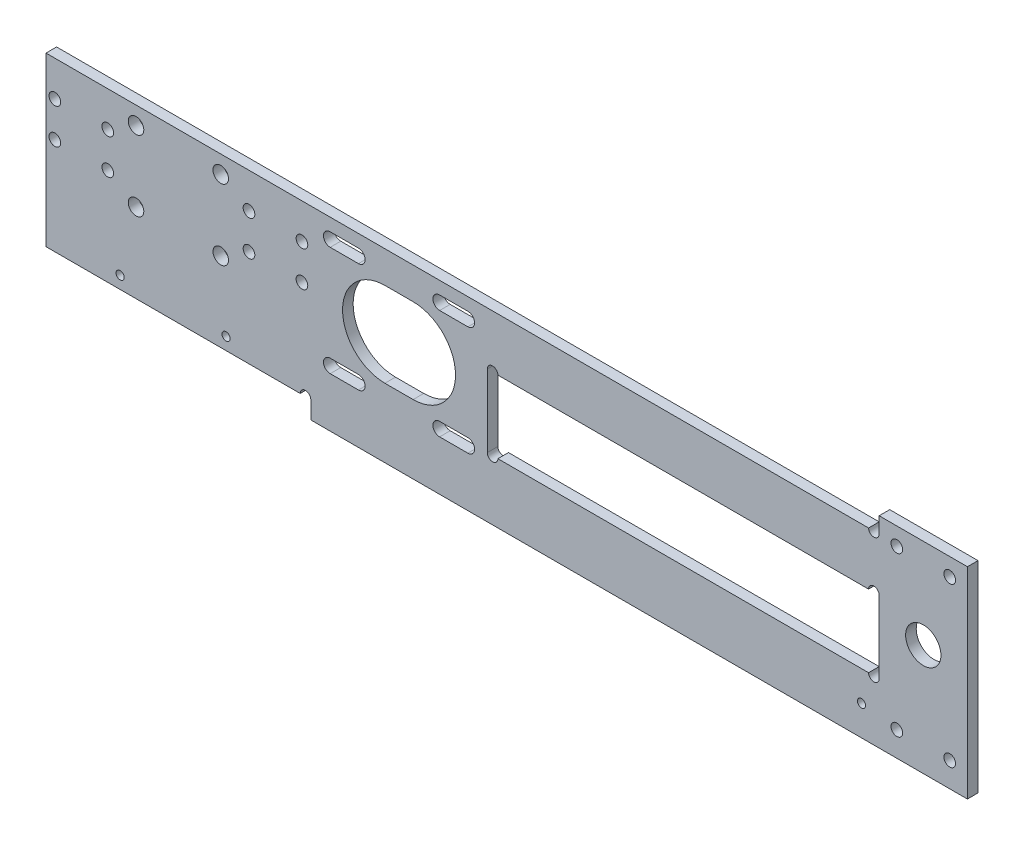
from build123d import *

# Parameters (mm, degrees)
SKETCH_1_W           = 75
SKETCH_1_H           = 30
EXTRUDE_1_DEPTH      = 3
HOLE_WIZARD_1_D      = 4.4
HOLE_WIZARD_2_D      = 3.3
SKETCH_8_W           = 45
SKETCH_8_H           = 42
EXTRUDE_2_DEPTH      = 3
HOLE_WIZARD_3_D      = 3.8
SKETCH_13_W          = 15
SKETCH_13_H          = 42
EXTRUDE_3_DEPTH      = 3
CUT_EXTRUDE_3_DEPTH  = 3
CUT_EXTRUDE_5_DEPTH  = 3
CUT_EXTRUDE_6_DEPTH  = 3
SKETCH_18_W          = 75
SKETCH_18_H          = 2.504084813
SKETCH_18_H_2        = 3
SKETCH_18_W_2        = 161
SKETCH_18_H_3        = 17
EXTRUDE_4_DEPTH      = 3
HOLE_WIZARD_4_D      = 2.3
SKETCH_22_W          = 25
SKETCH_22_H          = 42
EXTRUDE_5_DEPTH      = 3
HOLE_WIZARD_5_D      = 10
HOLE_WIZARD_5_DEPTH  = 3
HOLE_WIZARD_7_D      = 3.3
HOLE_WIZARD_7_DEPTH  = 3.001
SKETCH_31_W          = 25
SKETCH_31_H          = 15
EXTRUDE_6_DEPTH      = 3
HOLE_WIZARD_8_D      = 3.3
HOLE_WIZARD_8_DEPTH  = 3
SKETCH_36_W          = 161
SKETCH_36_H          = 15
EXTRUDE_7_DEPTH      = 3
HOLE_WIZARD_9_D      = 2.3
SKETCH_40_R          = 12
CUT_EXTRUDE_7_DEPTH  = 10
SKETCH_41_W          = 50
SKETCH_41_H          = 20.504084813
EXTRUDE_8_DEPTH      = 3
HOLE_WIZARD_10_D     = 3.8
HOLE_WIZARD_11_D     = 24
SKETCH_48_W          = 8
SKETCH_48_H          = 3.8
SKETCH_48_H_2        = 24
CUT_EXTRUDE_8_DEPTH  = 3
SKETCH_49_W          = 57
SKETCH_49_H          = 42
CUT_EXTRUDE_9_DEPTH  = 3
SKETCH_50_W          = 3
SKETCH_50_H          = 42
CUT_EXTRUDE_10_DEPTH = 3
SKETCH_51_W          = 75
SKETCH_51_H          = 5
CUT_EXTRUDE_11_DEPTH = 10
HOLE_WIZARD_12_D     = 3
HOLE_WIZARD_13_D     = 3


with BuildPart() as part:
    # 草图1 → 凸台-拉伸1 (new body)
    with BuildSketch(Plane.XY):
        with Locations((37.5, 15)):
            Rectangle(SKETCH_1_W, SKETCH_1_H)
    extrude(amount=EXTRUDE_1_DEPTH)

    # 孔1 (through all)
    with Locations(Plane.XY.offset(3)):
        with Locations((25.5, 25), (49.5, 25), (49.5, 5), (25.5, 5)):
            Hole(HOLE_WIZARD_1_D / 2)

    # 孔2 (through all)
    with Locations(Plane.XY.offset(3)):
        with Locations((2.5, 20), (17.5, 20), (17.5, 10), (2.5, 10), (57.5, 10), (57.5, 20), (72.5, 20), (72.5, 10)):
            Hole(HOLE_WIZARD_2_D / 2)

    # 草图8 → 凸台-拉伸2 (add)
    with BuildSketch(Plane(origin=(0, 0, 0), x_dir=(-1, 0, 0), z_dir=(0, 0, -1))):
        with Locations((22.5, 9)):
            Rectangle(SKETCH_8_W, SKETCH_8_H)
    extrude(amount=-EXTRUDE_2_DEPTH)

    # 孔3 (through all)
    with Locations(Plane.XY.offset(3)):
        with Locations((-39.5, 24.5), (-8.5, 24.5), (-8.5, -6.5), (-39.5, -6.5)):
            Hole(HOLE_WIZARD_3_D / 2)

    # 草图13 → 凸台-拉伸3 (add)
    with BuildSketch(Plane(origin=(0, 0, 0), x_dir=(-1, 0, 0), z_dir=(0, 0, -1))):
        with Locations((52.5, 9)):
            Rectangle(SKETCH_13_W, SKETCH_13_H)
    extrude(amount=-EXTRUDE_3_DEPTH)

    # 草图14 → 切除-拉伸3 (cut)
    with BuildSketch(Plane(origin=(0, 0, 0), x_dir=(-1, 0, 0), z_dir=(0, 0, -1))):
        with BuildLine():
            Line((23.5, 26.4), (8.5, 26.4))
            ThreePointArc((8.5, 26.4), (9.843502884, 25.843502884), (10.4, 24.5))
            ThreePointArc((10.4, 24.5), (9.843502884, 23.156497116), (8.5, 22.6))
            Line((8.5, 22.6), (23.5, 22.6))
            ThreePointArc((23.5, 22.6), (21.6, 24.5), (23.5, 26.4))
        make_face()
        with BuildLine():
            ThreePointArc((25.4, 24.5), (24.843502884, 25.843502884), (23.5, 26.4))
            Line((23.5, 26.4), (23.5, 22.6))
            ThreePointArc((23.5, 22.6), (24.843502884, 23.156497116), (25.4, 24.5))
        make_face()
        with BuildLine():
            Line((23.5, 22.6), (23.5, 26.4))
            ThreePointArc((23.5, 26.4), (21.6, 24.5), (23.5, 22.6))
        make_face()
        with BuildLine():
            ThreePointArc((10.4, 24.5), (9.843502884, 25.843502884), (8.5, 26.4))
            Line((8.5, 26.4), (8.5, 22.6))
            ThreePointArc((8.5, 22.6), (9.843502884, 23.156497116), (10.4, 24.5))
        make_face()
        with BuildLine():
            Line((8.5, 22.6), (8.5, 26.4))
            ThreePointArc((8.5, 26.4), (6.6, 24.5), (8.5, 22.6))
        make_face()
        with BuildLine():
            Line((23.5, -4.6), (8.5, -4.6))
            ThreePointArc((8.5, -4.6), (9.843502884, -5.156497116), (10.4, -6.5))
            ThreePointArc((10.4, -6.5), (9.843502884, -7.843502884), (8.5, -8.4))
            Line((8.5, -8.4), (23.5, -8.4))
            ThreePointArc((23.5, -8.4), (21.6, -6.5), (23.5, -4.6))
        make_face()
        with BuildLine():
            ThreePointArc((10.4, -6.5), (9.843502884, -5.156497116), (8.5, -4.6))
            Line((8.5, -4.6), (8.5, -8.4))
            ThreePointArc((8.5, -8.4), (9.843502884, -7.843502884), (10.4, -6.5))
        make_face()
        with BuildLine():
            Line((8.5, -8.4), (8.5, -4.6))
            ThreePointArc((8.5, -4.6), (6.6, -6.5), (8.5, -8.4))
        make_face()
        with BuildLine():
            ThreePointArc((25.4, -6.5), (24.843502884, -5.156497116), (23.5, -4.6))
            Line((23.5, -4.6), (23.5, -8.4))
            ThreePointArc((23.5, -8.4), (24.843502884, -7.843502884), (25.4, -6.5))
        make_face()
        with BuildLine():
            Line((23.5, -8.4), (23.5, -4.6))
            ThreePointArc((23.5, -4.6), (21.6, -6.5), (23.5, -8.4))
        make_face()
        with BuildLine():
            ThreePointArc((39.5, 26.4), (40.843502884, 25.843502884), (41.4, 24.5))
            Line((41.4, 24.5), (52.6, 24.5))
            ThreePointArc((52.6, 24.5), (53.156497116, 25.843502884), (54.5, 26.4))
            Line((54.5, 26.4), (39.5, 26.4))
        make_face()
        with BuildLine():
            Line((52.6, 24.5), (41.4, 24.5))
            ThreePointArc((41.4, 24.5), (40.843502884, 23.156497116), (39.5, 22.6))
            Line((39.5, 22.6), (54.5, 22.6))
            ThreePointArc((54.5, 22.6), (53.156497116, 23.156497116), (52.6, 24.5))
        make_face()
        with BuildLine():
            Line((41.4, 24.5), (39.5, 24.5))
            Line((39.5, 24.5), (39.5, 22.6))
            ThreePointArc((39.5, 22.6), (40.843502884, 23.156497116), (41.4, 24.5))
        make_face()
        with BuildLine():
            Line((39.5, 26.4), (39.5, 24.5))
            Line((39.5, 24.5), (41.4, 24.5))
            ThreePointArc((41.4, 24.5), (40.843502884, 25.843502884), (39.5, 26.4))
        make_face()
        with BuildLine():
            Line((39.5, 22.6), (39.5, 24.5))
            Line((39.5, 24.5), (39.5, 26.4))
            ThreePointArc((39.5, 26.4), (37.6, 24.5), (39.5, 22.6))
        make_face()
        with BuildLine():
            Line((54.5, 24.5), (54.5, 22.6))
            ThreePointArc((54.5, 22.6), (55.843502884, 23.156497116), (56.4, 24.5))
            ThreePointArc((56.4, 24.5), (55.843502884, 25.843502884), (54.5, 26.4))
            Line((54.5, 26.4), (54.5, 24.5))
        make_face()
        with BuildLine():
            Line((54.5, 24.5), (52.6, 24.5))
            ThreePointArc((52.6, 24.5), (53.156497116, 23.156497116), (54.5, 22.6))
            Line((54.5, 22.6), (54.5, 24.5))
        make_face()
        with BuildLine():
            ThreePointArc((54.5, 26.4), (53.156497116, 25.843502884), (52.6, 24.5))
            Line((52.6, 24.5), (54.5, 24.5))
            Line((54.5, 24.5), (54.5, 26.4))
        make_face()
        with BuildLine():
            Line((54.5, -4.6), (39.5, -4.6))
            ThreePointArc((39.5, -4.6), (40.843502884, -5.156497116), (41.4, -6.5))
            Line((41.4, -6.5), (52.6, -6.5))
            ThreePointArc((52.6, -6.5), (53.156497116, -5.156497116), (54.5, -4.6))
        make_face()
        with BuildLine():
            Line((52.6, -6.5), (41.4, -6.5))
            ThreePointArc((41.4, -6.5), (40.843502884, -7.843502884), (39.5, -8.4))
            Line((39.5, -8.4), (54.5, -8.4))
            ThreePointArc((54.5, -8.4), (53.156497116, -7.843502884), (52.6, -6.5))
        make_face()
        with BuildLine():
            Line((54.5, -6.5), (54.5, -4.6))
            ThreePointArc((54.5, -4.6), (53.156497116, -5.156497116), (52.6, -6.5))
            Line((52.6, -6.5), (54.5, -6.5))
        make_face()
        with BuildLine():
            Line((54.5, -8.4), (54.5, -6.5))
            Line((54.5, -6.5), (52.6, -6.5))
            ThreePointArc((52.6, -6.5), (53.156497116, -7.843502884), (54.5, -8.4))
        make_face()
        with BuildLine():
            ThreePointArc((56.4, -6.5), (55.843502884, -5.156497116), (54.5, -4.6))
            Line((54.5, -4.6), (54.5, -6.5))
            Line((54.5, -6.5), (54.5, -8.4))
            ThreePointArc((54.5, -8.4), (55.843502884, -7.843502884), (56.4, -6.5))
        make_face()
        with BuildLine():
            ThreePointArc((41.4, -6.5), (40.843502884, -5.156497116), (39.5, -4.6))
            Line((39.5, -4.6), (39.5, -6.5))
            Line((39.5, -6.5), (41.4, -6.5))
        make_face()
        with BuildLine():
            Line((41.4, -6.5), (39.5, -6.5))
            Line((39.5, -6.5), (39.5, -8.4))
            ThreePointArc((39.5, -8.4), (40.843502884, -7.843502884), (41.4, -6.5))
        make_face()
        with BuildLine():
            Line((39.5, -6.5), (39.5, -4.6))
            ThreePointArc((39.5, -4.6), (37.6, -6.5), (39.5, -8.4))
            Line((39.5, -8.4), (39.5, -6.5))
        make_face()
    extrude(amount=-CUT_EXTRUDE_3_DEPTH, mode=Mode.SUBTRACT)

    # 草图16 → 切除-拉伸5 (cut)
    with BuildSketch(Plane(origin=(0, 0, 0), x_dir=(-1, 0, 0), z_dir=(0, 0, -1))):
        with BuildLine():
            Line((24, 20.504084813), (24, -2.489125293))
            Line((24, -2.489125293), (39.5, -2.489125293))
            ThreePointArc((39.5, -2.489125293), (50.5, 9), (39.5, 20.489125293))
            Line((39.5, 20.489125293), (39.5, 20.504084813))
            Line((39.5, 20.504084813), (24, 20.504084813))
        make_face()
    extrude(amount=-CUT_EXTRUDE_5_DEPTH, mode=Mode.SUBTRACT)

    # 草图17 → 切除-拉伸6 (cut)
    with BuildSketch(Plane(origin=(0, 0, 0), x_dir=(-1, 0, 0), z_dir=(0, 0, -1))):
        with BuildLine():
            Line((24, -2.489125293), (24, 20.504084813))
            ThreePointArc((24, 20.504084813), (12.495915187, 9), (24, -2.504084813))
            Line((24, -2.504084813), (24, -2.489125293))
        make_face()
    extrude(amount=-CUT_EXTRUDE_6_DEPTH, mode=Mode.SUBTRACT)

    # 草图18 → 凸台-拉伸4 (add)
    with BuildSketch(Plane(origin=(0, 0, 0), x_dir=(-1, 0, 0), z_dir=(0, 0, -1))):
        with Locations((-37.5, -1.252042406)):
            Rectangle(SKETCH_18_W, SKETCH_18_H)
        with Locations((-37.5, -4.004084813)):
            Rectangle(SKETCH_18_W, SKETCH_18_H_2)
        Polygon((0, -12), (0, -5.504084813), (-75, -5.504084813), (-75, -22.504084813), (0, -22.504084813), align=None)
        with Locations((-155.5, -14.004084813)):
            Rectangle(SKETCH_18_W_2, SKETCH_18_H_3)
    extrude(amount=-EXTRUDE_4_DEPTH)

    # 孔4 (through all)
    with Locations(Plane.XY.offset(3)):
        with Locations((51, -14.004084813), (231, -14.004084813)):
            Hole(HOLE_WIZARD_4_D / 2)

    # 草图22 → 凸台-拉伸5 (add)
    with BuildSketch(Plane(origin=(0, 0, 0), x_dir=(-1, 0, 0), z_dir=(0, 0, -1))):
        with Locations((-248.5, -1.504084813)):
            Rectangle(SKETCH_22_W, SKETCH_22_H)
    extrude(amount=-EXTRUDE_5_DEPTH)

    # 孔5
    with Locations(Plane(origin=(0, 0, 0), x_dir=(-1, 0, 0), z_dir=(0, 0, -1))):
        with Locations((-248.5, 8.995915187), (-277.5, 6.995915187)):
            Hole(HOLE_WIZARD_5_D / 2, depth=HOLE_WIZARD_5_DEPTH)

    # 孔7
    with Locations(Plane(origin=(0, 0, 0), x_dir=(-1, 0, 0), z_dir=(0, 0, -1))):
        with Locations((-241, -15.504084813), (-285, -15.504084813), (-270, -15.504084813), (-256, -15.504084813)):
            Hole(HOLE_WIZARD_7_D / 2, depth=HOLE_WIZARD_7_DEPTH)

    # 草图31 → 凸台-拉伸6 (add)
    with BuildSketch(Plane(origin=(0, 0, 0), x_dir=(-1, 0, 0), z_dir=(0, 0, -1))):
        with Locations((-248.5, 26.995915187)):
            Rectangle(SKETCH_31_W, SKETCH_31_H)
    extrude(amount=-EXTRUDE_6_DEPTH)

    # 孔8
    with Locations(Plane(origin=(0, 0, 0), x_dir=(-1, 0, 0), z_dir=(0, 0, -1))):
        with Locations((-241, 29.495915187), (-285, 29.495915187), (-270, 29.495915187), (-256, 29.495915187)):
            Hole(HOLE_WIZARD_8_D / 2, depth=HOLE_WIZARD_8_DEPTH)

    # 草图36 → 凸台-拉伸7 (add)
    with BuildSketch(Plane(origin=(0, 0, 0), x_dir=(-1, 0, 0), z_dir=(0, 0, -1))):
        with Locations((-155.5, 22.5)):
            Rectangle(SKETCH_36_W, SKETCH_36_H)
    extrude(amount=-EXTRUDE_7_DEPTH)

    # 孔9 (through all)
    with Locations(Plane(origin=(0, 0, 0), x_dir=(-1, 0, 0), z_dir=(0, 0, -1))):
        with Locations((-21, -14.004084813)):
            Hole(HOLE_WIZARD_9_D / 2)

    # 草图40 → 切除-拉伸7 (cut)
    with BuildSketch(Plane(origin=(0, 0, 0), x_dir=(-1, 0, 0), z_dir=(0, 0, -1))):
        with Locations((39, 9)):
            Circle(SKETCH_40_R)
        with Locations((24, 9)):
            Circle(SKETCH_40_R)
        with BuildLine():
            Line((39, 21), (24, 21))
            ThreePointArc((24, 21), (27.974294656, 20.322763885), (31.5, 18.367496998))
            ThreePointArc((31.5, 18.367496998), (35.025705344, 20.322763885), (39, 21))
        make_face()
        with BuildLine():
            ThreePointArc((31.5, -0.367496998), (27.974294656, -2.322763885), (24, -3))
            Line((24, -3), (39, -3))
            ThreePointArc((39, -3), (35.025705344, -2.322763885), (31.5, -0.367496998))
        make_face()
    extrude(amount=-CUT_EXTRUDE_7_DEPTH, mode=Mode.SUBTRACT)

    # 草图41 → 凸台-拉伸8 (add)
    with BuildSketch(Plane(origin=(0, 0, 0), x_dir=(-1, 0, 0), z_dir=(0, 0, -1))):
        with Locations((-100, 4.747957594)):
            Rectangle(SKETCH_41_W, SKETCH_41_H)
    extrude(amount=-EXTRUDE_8_DEPTH)

    # 孔10 (through all)
    with Locations(Plane(origin=(0, 0, 0), x_dir=(-1, 0, 0), z_dir=(0, 0, -1))):
        with Locations((-119.5, 24.5), (-111.5, 24.5), (-88.5, 24.5), (-80.5, 24.5), (-88.5, -6.5), (-80.5, -6.5), (-119.5, -6.5), (-111.5, -6.5)):
            Hole(HOLE_WIZARD_10_D / 2)

    # 孔11 (through all)
    with Locations(Plane(origin=(0, 0, 0), x_dir=(-1, 0, 0), z_dir=(0, 0, -1))):
        with Locations((-104, 9), (-96, 9)):
            Hole(HOLE_WIZARD_11_D / 2)

    # 草图48 → 切除-拉伸8 (cut)
    with BuildSketch(Plane(origin=(0, 0, 0), x_dir=(-1, 0, 0), z_dir=(0, 0, -1))):
        with Locations((-115.5, 24.5)):
            Rectangle(SKETCH_48_W, SKETCH_48_H)
        with Locations((-84.5, 24.5)):
            Rectangle(SKETCH_48_W, SKETCH_48_H)
        with Locations((-115.5, -6.5)):
            Rectangle(SKETCH_48_W, SKETCH_48_H)
        with Locations((-84.5, -6.5)):
            Rectangle(SKETCH_48_W, SKETCH_48_H)
        with Locations((-100, 9)):
            Rectangle(SKETCH_48_W, SKETCH_48_H_2)
    extrude(amount=-CUT_EXTRUDE_8_DEPTH, mode=Mode.SUBTRACT)

    # 草图49 → 切除-拉伸9 (cut)
    with BuildSketch(Plane(origin=(0, 0, 0), x_dir=(-1, 0, 0), z_dir=(0, 0, -1))):
        with Locations((31.5, 9)):
            Rectangle(SKETCH_49_W, SKETCH_49_H)
    extrude(amount=-CUT_EXTRUDE_9_DEPTH, mode=Mode.SUBTRACT)

    # 草图50 → 切除-拉伸10 (cut)
    with BuildSketch(Plane(origin=(0, 0, 0), x_dir=(-1, 0, 0), z_dir=(0, 0, -1))):
        with Locations((1.5, 9)):
            Rectangle(SKETCH_50_W, SKETCH_50_H)
    extrude(amount=-CUT_EXTRUDE_10_DEPTH, mode=Mode.SUBTRACT)

    # 草图51 → 切除-拉伸11 (cut)
    with BuildSketch(Plane(origin=(0, 0, 0), x_dir=(-1, 0, 0), z_dir=(0, 0, -1))):
        with Locations((-37.5, -20.004084813)):
            Rectangle(SKETCH_51_W, SKETCH_51_H)
    extrude(amount=-CUT_EXTRUDE_11_DEPTH, mode=Mode.SUBTRACT)

    # 孔12 (through all)
    with Locations(Plane(origin=(0, 0, 0), x_dir=(-1, 0, 0), z_dir=(0, 0, -1))):
        with Locations((-234.5, 15), (-234.5, -5.504084813), (-126.5, -5.504084813), (-126.5, 15)):
            Hole(HOLE_WIZARD_12_D / 2)

    # 孔13 (through all)
    with Locations(Plane(origin=(0, 0, 0), x_dir=(-1, 0, 0), z_dir=(0, 0, -1))):
        with Locations((-234.5, 30), (-73.5, -17.504084813)):
            Hole(HOLE_WIZARD_13_D / 2)


solid = part.part
